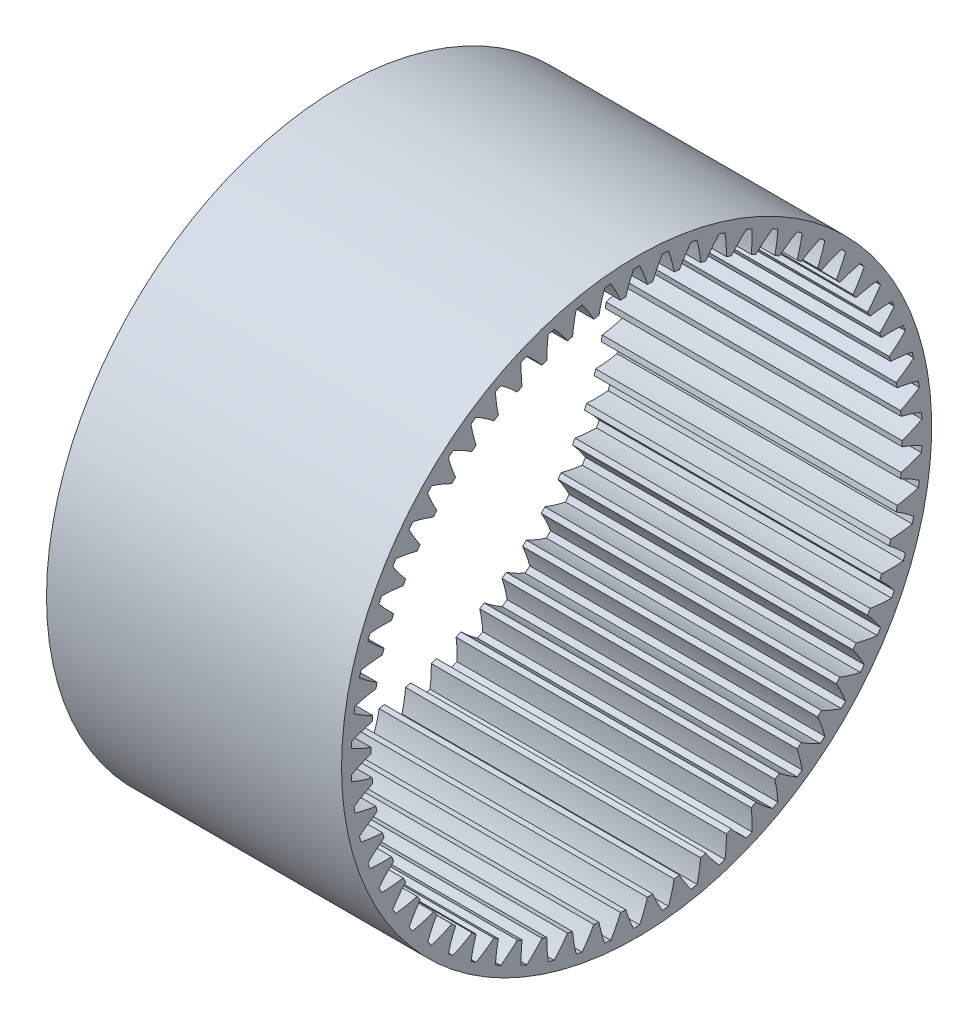
from build123d import *

# Parameters (mm, degrees)
BASPROSKE_W     = 20
BASPROSKE_H     = 2
TOOTHCUT_DEPTH  = 35.641016151
TEETHCUTS_COUNT = 62
TEETHCUTS_ANGLE = 354.193548387


with BuildPart() as part:
    # BasProSke → Base-Revolve (revolve)
    with BuildSketch(Plane(origin=(0, 0, 0), x_dir=(1, 0, 0), z_dir=(0, 1, 0)), mode=Mode.PRIVATE) as base_revolve_sk:
        with Locations((10, 19)):
            Rectangle(BASPROSKE_W, BASPROSKE_H)
    revolve(base_revolve_sk.sketch.rotate(Axis((-10, 0, 0), (1, 0, 0)), 180), axis=Axis((-10, 0, 0), (1, 0, 0)))

    # TooCutSke → ToothCut (cut, through all)
    with BuildSketch(Plane(origin=(0, 0, 0), x_dir=(0, 0, -1), z_dir=(1, 0, 0))):
        with BuildLine():
            ThreePointArc((0.739822827, 17.959368233), (0.501108898, 18.665322257), (0.206637724, 19.349896688))
            ThreePointArc((0.206637724, 19.349896688), (0, 19.351), (-0.206637724, 19.349896688))
            ThreePointArc((-0.206637724, 19.349896688), (-0.501108898, 18.665322257), (-0.739822827, 17.959368233))
            ThreePointArc((-0.739822827, 17.959368233), (0, 17.9746), (0.739822827, 17.959368233))
        make_face()
    toothcut = extrude(amount=TOOTHCUT_DEPTH, mode=Mode.SUBTRACT)

    # TeethCuts: ToothCut ×62 about axis
    teethcuts_axis = Axis((-10, 0, 0), (1, 0, 0))
    for i in range(1, TEETHCUTS_COUNT):
        add(toothcut.rotate(teethcuts_axis, i * TEETHCUTS_ANGLE / (TEETHCUTS_COUNT - 1)), mode=Mode.SUBTRACT)


solid = part.part
